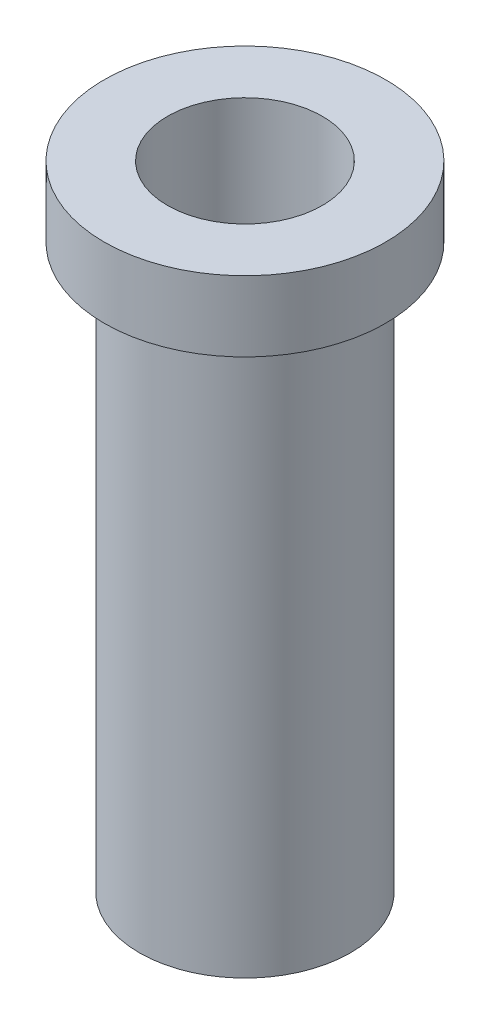
from build123d import *

# Parameters (mm, degrees)
SKETCH1_R           = 10
BOSS_EXTRUDE1_DEPTH = 5
SKETCH2_R           = 7.5
BOSS_EXTRUDE2_DEPTH = 40
SKETCH3_R           = 5.5
CUT_EXTRUDE1_DEPTH  = 48.16990566


with BuildPart() as part:
    # Sketch1 → Boss-Extrude1 (new body)
    with BuildSketch(Plane(origin=(0, 0, 0), x_dir=(1, 0, 0), z_dir=(0, 1, 0))):
        with Locations(Location((0, 0, 0), (0, 0, 270))):
            Circle(SKETCH1_R)
    extrude(amount=-BOSS_EXTRUDE1_DEPTH)

    # Sketch2 → Boss-Extrude2 (add)
    with BuildSketch(Plane.XZ.offset(5)):
        with Locations(Location((0, 0, 0), (0, 0, 90))):
            Circle(SKETCH2_R)
    extrude(amount=BOSS_EXTRUDE2_DEPTH)

    # Sketch3 → Cut-Extrude1 (cut, through all)
    with BuildSketch(Plane(origin=(0, 0, 0), x_dir=(1, 0, 0), z_dir=(0, 1, 0))):
        with Locations(Location((0, 0, 0), (0, 0, 270))):
            Circle(SKETCH3_R)
    extrude(amount=-CUT_EXTRUDE1_DEPTH, mode=Mode.SUBTRACT)


solid = part.part
